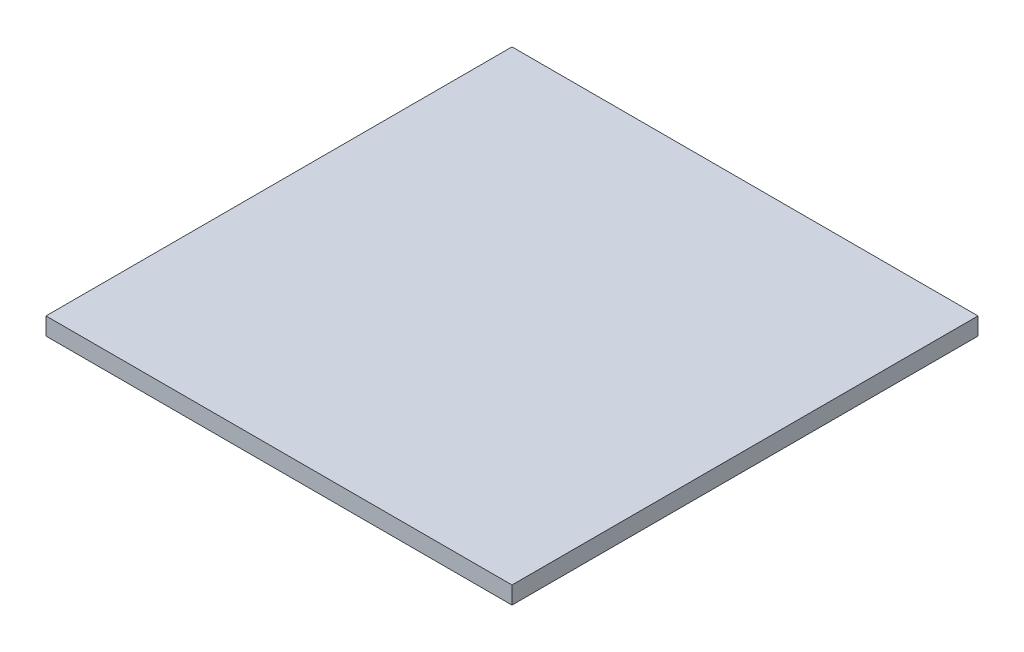
from build123d import *

# Parameters (mm, degrees)
SKETCH1_W           = 40
SKETCH1_H           = 40
BOSS_EXTRUDE1_DEPTH = 1.5


with BuildPart() as part:
    # Sketch1 → Boss-Extrude1 (new body)
    with BuildSketch(Plane(origin=(0, 0, 0), x_dir=(1, 0, 0), z_dir=(0, 1, 0))):
        Rectangle(SKETCH1_W, SKETCH1_H)
    extrude(amount=BOSS_EXTRUDE1_DEPTH)


solid = part.part
